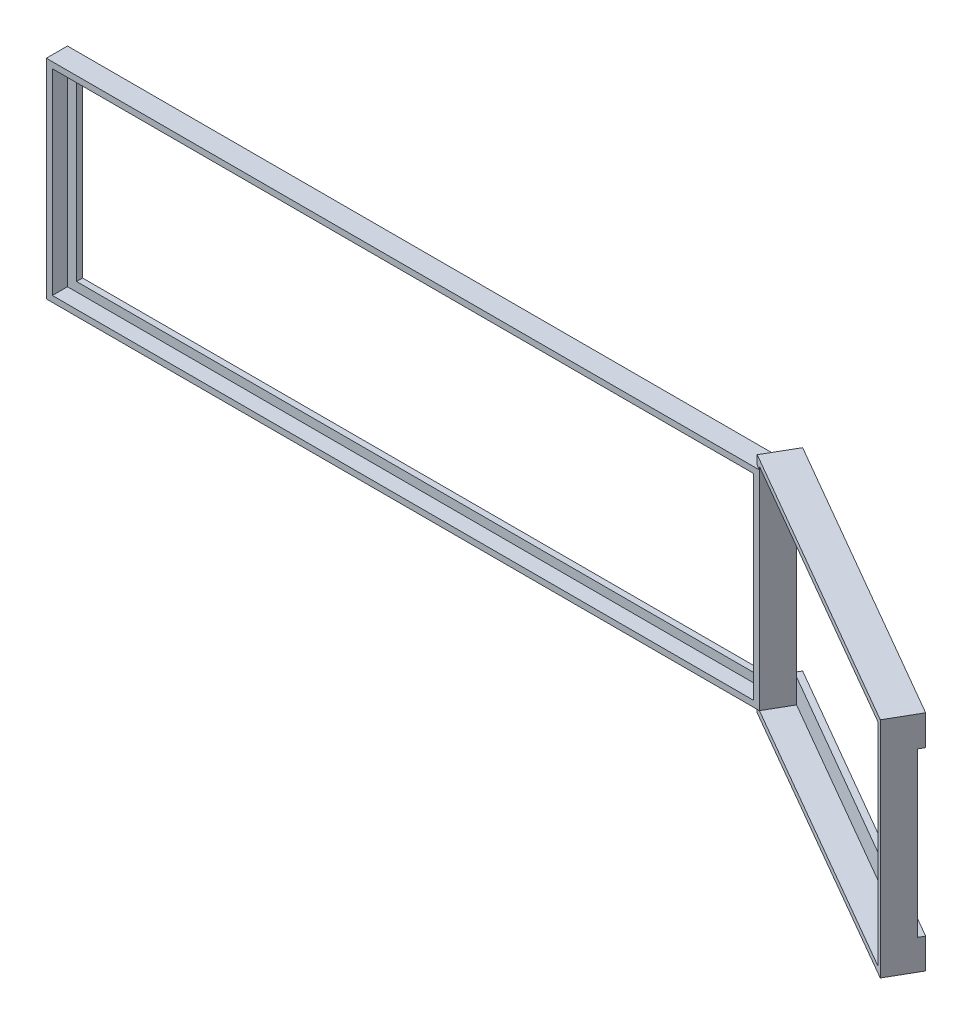
from build123d import *

# Parameters (mm, degrees)
SKETCH1_W                   = 236
SKETCH1_H                   = 69
SKETCH1_W_2                 = 232
SKETCH1_H_2                 = 65
DISPLAY_OUTLINE_DEPTH       = 5
SKETCH3_W                   = 236
SKETCH3_H                   = 69
SKETCH3_W_2                 = 226
SKETCH3_H_2                 = 59
REAR_DISPLAY_RETAINER_DEPTH = 2
SKETCH2_W                   = 74
SKETCH2_H                   = 111.25
SKETCH2_W_2                 = 70
SKETCH2_H_2                 = 107.25
STREAM_DECK_OUTLINE_DEPTH   = 9
STREAM_DECK_RETAINER_DEPTH  = 2


with BuildPart() as part:
    # Sketch1 → Display outline (new body)
    with BuildSketch(Plane.XY):
        Rectangle(SKETCH1_W, SKETCH1_H)
        Rectangle(SKETCH1_W_2, SKETCH1_H_2, mode=Mode.SUBTRACT)
    extrude(amount=DISPLAY_OUTLINE_DEPTH)

    # Sketch3 → Rear display retainer (add)
    with BuildSketch(Plane(origin=(0, 0, 0), x_dir=(-1, 0, 0), z_dir=(0, 0, -1))):
        Rectangle(SKETCH3_W, SKETCH3_H)
        Rectangle(SKETCH3_W_2, SKETCH3_H_2, mode=Mode.SUBTRACT)
    extrude(amount=REAR_DISPLAY_RETAINER_DEPTH)

    # Sketch2 → Stream deck outline (add)
    with BuildSketch(Plane(origin=(27.334936491, 0, -47.345498823), x_dir=(0, 1, 0), z_dir=(-0.5000000000000041, 0, 0.8660254037844364))):
        with Locations((0.5, -158.315997647)):
            Rectangle(SKETCH2_W, SKETCH2_H)
        with Locations((0.5, -158.315997647)):
            Rectangle(SKETCH2_W_2, SKETCH2_H_2, mode=Mode.SUBTRACT)
    extrude(amount=-STREAM_DECK_OUTLINE_DEPTH)

    # Sketch4 → Stream deck retainer (add)
    with BuildSketch(Plane(origin=(31.834936491, 0, -55.139727457), x_dir=(-0.8660254037844363, 0, -0.5000000000000042), z_dir=(0.5000000000000041, 0, -0.8660254037844362))):
        with BuildLine():
            Line((-213.940997647, 27.5), (-205.940997647, 27.5))
            ThreePointArc((-205.940997647, 27.5), (-204.526784084, 28.085786438), (-203.940997647, 29.5))
            Line((-203.940997647, 29.5), (-203.940997647, 32.5))
            ThreePointArc((-203.940997647, 32.5), (-203.355211209, 33.914213562), (-201.940997647, 34.5))
            Line((-201.940997647, 34.5), (-179.940997647, 34.5))
            ThreePointArc((-179.940997647, 34.5), (-178.526784084, 33.914213562), (-177.940997647, 32.5))
            Line((-177.940997647, 32.5), (-177.940997647, 29.5))
            ThreePointArc((-177.940997647, 29.5), (-177.355211209, 28.085786438), (-175.940997647, 27.5))
            Line((-175.940997647, 27.5), (-102.690997647, 27.5))
            Line((-102.690997647, 27.5), (-102.690997647, 37.5))
            Line((-102.690997647, 37.5), (-213.940997647, 37.5))
            Line((-213.940997647, 37.5), (-213.940997647, 27.5))
        make_face()
        with BuildLine():
            Line((-102.690997647, -36.5), (-102.690997647, -26.5))
            Line((-102.690997647, -26.5), (-183.940997647, -26.5))
            ThreePointArc((-183.940997647, -26.5), (-185.355211209, -27.085786438), (-185.940997647, -28.5))
            Line((-185.940997647, -28.5), (-185.940997647, -31.5))
            ThreePointArc((-185.940997647, -31.5), (-186.526784084, -32.914213562), (-187.940997647, -33.5))
            Line((-187.940997647, -33.5), (-192.940997647, -33.5))
            ThreePointArc((-192.940997647, -33.5), (-194.355211209, -32.914213562), (-194.940997647, -31.5))
            Line((-194.940997647, -31.5), (-194.940997647, -28.5))
            ThreePointArc((-194.940997647, -28.5), (-195.526784084, -27.085786438), (-196.940997647, -26.5))
            Line((-196.940997647, -26.5), (-213.940997647, -26.5))
            Line((-213.940997647, -26.5), (-213.940997647, -36.5))
            Line((-213.940997647, -36.5), (-102.690997647, -36.5))
        make_face()
    extrude(amount=STREAM_DECK_RETAINER_DEPTH)


solid = part.part
